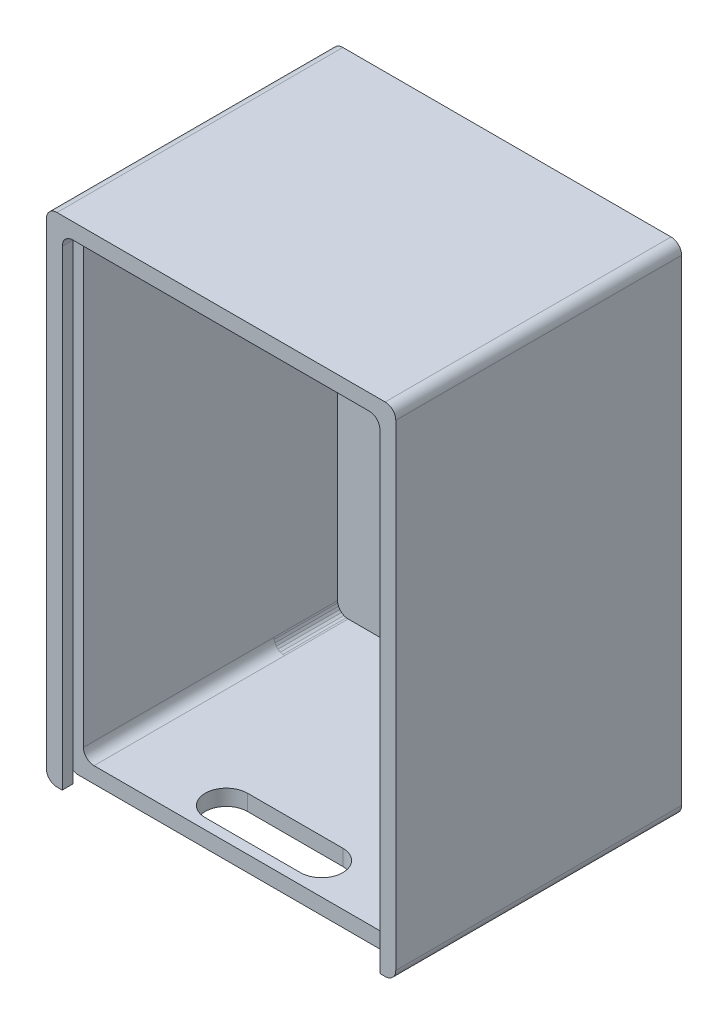
from build123d import *

# Parameters (mm, degrees)
ESQUISSE1_W              = 3.3
ESQUISSE1_H              = 4.7
BOSS_EXTRU_1_DEPTH       = 2.7
CONG_4_R                 = 0.1
CONG_5_R                 = 0.1
ESQUISSE2_W              = 3
ESQUISSE2_H              = 4.4
ENL_V_MAT_EXTRU_2_DEPTH  = 2
CONG_8_R                 = 0.1
ESQUISSE5_W              = 1.1
ESQUISSE5_H              = 1.1
ESQUISSE5_W_2            = 0.9
ESQUISSE5_H_2            = 0.9
BOSS_EXTRU_3_DEPTH       = 0.5
ESQUISSE6_W              = 0.9
ESQUISSE6_H              = 0.9
ENL_V_MAT_EXTRU_4_DEPTH  = 0.5
ENL_V_MAT_EXTRU_5_DEPTH  = 0.2
ESQUISSE8_W              = 0.1
ESQUISSE8_H              = 4.45
ENL_V_MAT_EXTRU_6_DEPTH  = 0.1
ESQUISSE10_W             = 0.1
ESQUISSE10_H             = 4.45
ENL_V_MAT_EXTRU_7_DEPTH  = 0.1
ESQUISSE11_W             = 0.9
ESQUISSE11_H             = 0.9
ENL_V_MAT_EXTRU_8_DEPTH  = 1
ESQUISSE12_R             = 0.2
ESQUISSE12_W             = 0.9
ESQUISSE12_H             = 0.4
ENL_V_MAT_EXTRU_9_DEPTH  = 1.1
ENL_V_MAT_EXTRU_11_DEPTH = 0.6


with BuildPart() as part:
    # Esquisse1 → Boss.-Extru.1 (new body)
    with BuildSketch(Plane.XY):
        with Locations((-1.65, 2.35)):
            Rectangle(ESQUISSE1_W, ESQUISSE1_H)
    extrude(amount=BOSS_EXTRU_1_DEPTH)

    # Congé4
    cong_4_edges = [part.edges().sort_by_distance(p)[0] for p in [
        (-3.3, 4.7, 1.35),
    ]]
    fillet(cong_4_edges, radius=CONG_4_R)

    # Congé5
    cong_5_edges = [part.edges().sort_by_distance(p)[0] for p in [
        (0, 0, 1.35),
        (-3.3, 0, 1.35),
        (0, 4.7, 1.35),
    ]]
    fillet(cong_5_edges, radius=CONG_5_R)

    # Esquisse2 → Enlèv. mat.-Extru.2 (cut)
    with BuildSketch(Plane.XY.offset(2.7)):
        with Locations((-1.65, 2.35)):
            Rectangle(ESQUISSE2_W, ESQUISSE2_H)
    extrude(amount=-ENL_V_MAT_EXTRU_2_DEPTH, mode=Mode.SUBTRACT)

    # Congé8
    cong_8_edges = [part.edges().sort_by_distance(p)[0] for p in [
        (-0.15, 0.15, 1.7),
        (-3.15, 0.15, 1.7),
        (-3.15, 4.55, 1.7),
        (-0.15, 4.55, 1.7),
    ]]
    fillet(cong_8_edges, radius=CONG_8_R)

    # Esquisse5 → Boss.-Extru.3 (add)
    with BuildSketch(Plane(origin=(0, 0, 0), x_dir=(-1, 0, 0), z_dir=(0, 0, -1))):
        with Locations((1.65, 3.45)):
            Rectangle(ESQUISSE5_W, ESQUISSE5_H)
        with Locations((1.65, 3.45)):
            Rectangle(ESQUISSE5_W_2, ESQUISSE5_H_2, mode=Mode.SUBTRACT)
    extrude(amount=BOSS_EXTRU_3_DEPTH)

    # Esquisse6 → Enlèv. mat.-Extru.4 (cut)
    with BuildSketch(Plane(origin=(0, 0, 0), x_dir=(-1, 0, 0), z_dir=(0, 0, -1))):
        with Locations((1.65, 3.45)):
            Rectangle(ESQUISSE6_W, ESQUISSE6_H)
    extrude(amount=-ENL_V_MAT_EXTRU_4_DEPTH, mode=Mode.SUBTRACT)

    # Esquisse7 → Enlèv. mat.-Extru.5 (cut)
    with BuildSketch(Plane.XY.offset(2.7)):
        Polygon((-3.15, 0.25), (-3.15, 0), (-0.15, 0), (-0.15, 0.25), (-0.153597253, 0.223419736), (-0.163814969, 0.199283726), (-0.179289322, 0.179289322), (-0.199283726, 0.163814969), (-0.223419736, 0.153597253), (-0.25, 0.15), (-3.05, 0.15), (-3.075882726, 0.153407637), (-3.101785208, 0.164452982), (-3.120710678, 0.179289322), (-3.136185031, 0.199283726), (-3.146402747, 0.223419736), align=None)
    extrude(amount=-ENL_V_MAT_EXTRU_5_DEPTH, mode=Mode.SUBTRACT)

    # Esquisse8 → Enlèv. mat.-Extru.6 (cut)
    with BuildSketch(Plane(origin=(-3.15, 0, 0), x_dir=(0, 0, -1), z_dir=(1, 0, 0))):
        with Locations((-2.55, 2.225)):
            Rectangle(ESQUISSE8_W, ESQUISSE8_H)
    extrude(amount=-ENL_V_MAT_EXTRU_6_DEPTH, mode=Mode.SUBTRACT)

    # Esquisse10 → Enlèv. mat.-Extru.7 (cut)
    with BuildSketch(Plane.ZY.offset(0.15)):
        with Locations((2.55, 2.225)):
            Rectangle(ESQUISSE10_W, ESQUISSE10_H)
    extrude(amount=-ENL_V_MAT_EXTRU_7_DEPTH, mode=Mode.SUBTRACT)

    # Esquisse11 → Enlèv. mat.-Extru.8 (cut)
    with BuildSketch(Plane(origin=(0, 0, 0.5), x_dir=(-1, 0, 0), z_dir=(0, 0, -1))):
        with Locations((1.65, 3.45)):
            Rectangle(ESQUISSE11_W, ESQUISSE11_H)
    extrude(amount=-ENL_V_MAT_EXTRU_8_DEPTH, mode=Mode.SUBTRACT)

    # Esquisse12 → Enlèv. mat.-Extru.9 (cut)
    with BuildSketch(Plane(origin=(0, 0, 0), x_dir=(-1, 0, 0), z_dir=(0, -1, 0))):
        with Locations((2.1, -2.2)):
            Circle(ESQUISSE12_R)
        with Locations((1.2, -2.2)):
            Circle(ESQUISSE12_R)
        with Locations((1.65, -2.2)):
            Rectangle(ESQUISSE12_W, ESQUISSE12_H)
    extrude(amount=-ENL_V_MAT_EXTRU_9_DEPTH, mode=Mode.SUBTRACT)

    # Esquisse15 → Enlèv. mat.-Extru.11 (cut)
    with BuildSketch(Plane.XY.offset(0.7)):
        Polygon((-3.05, 4.55), (-3.074637758, 4.546917392), (-3.098981719, 4.537182517), (-3.120710678, 4.520710678), (-3.135617823, 4.50166806), (-3.146075217, 4.477740811), (-3.15, 4.45), (-3.15, 0.25), (-3.148425664, 0.232325479), (-3.14084652, 0.20820395), (-3.12816425, 0.18762733), (-3.111972277, 0.17151792), (-3.089747782, 0.158238822), (-3.066631653, 0.151392758), (-3.05, 0.15), (-0.25, 0.15), (-0.232325479, 0.151574336), (-0.210252218, 0.158238822), (-0.188027723, 0.17151792), (-0.171202141, 0.188429736), (-0.158443213, 0.209783651), (-0.151309025, 0.233872648), (-0.15, 0.25), (-0.15, 4.45), (-0.153924783, 4.477740811), (-0.164382177, 4.50166806), (-0.179289322, 4.520710678), (-0.19833194, 4.535617823), (-0.222259189, 4.546075217), (-0.25, 4.55), align=None)
    extrude(amount=-ENL_V_MAT_EXTRU_11_DEPTH, mode=Mode.SUBTRACT)


solid = part.part
